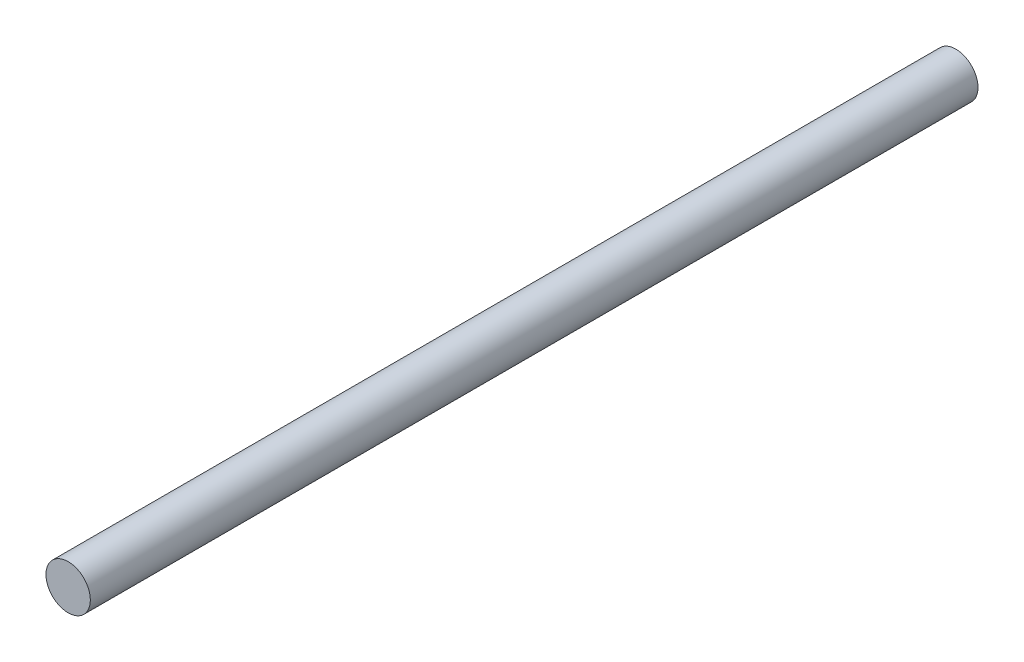
from build123d import *

# Parameters (mm, degrees)
SKETCH1_R           = 6.25
BOSS_EXTRUDE1_DEPTH = 250


with BuildPart() as part:
    # Sketch1 → Boss-Extrude1 (new body)
    with BuildSketch(Plane.XY):
        Circle(SKETCH1_R)
    extrude(amount=BOSS_EXTRUDE1_DEPTH)


solid = part.part
